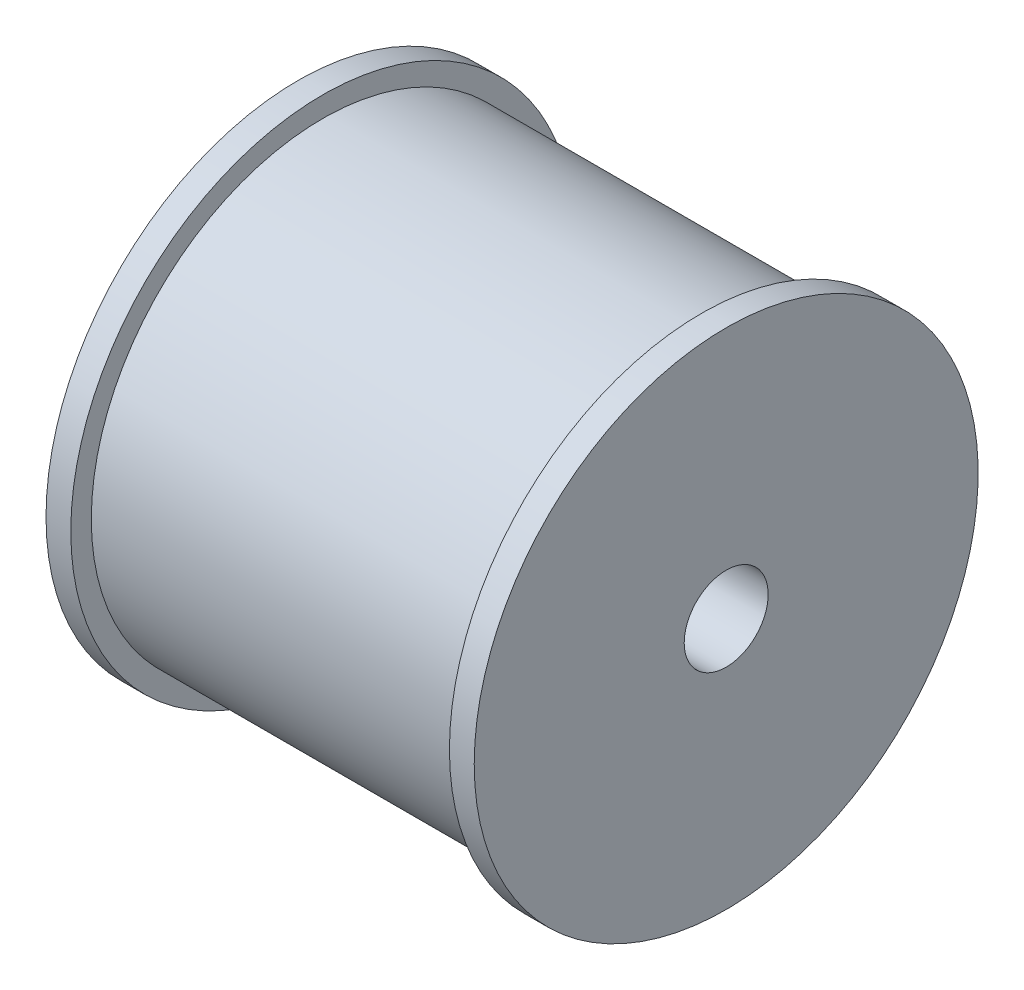
from build123d import *


with BuildPart() as part:
    # Sketch1 → Revolve1 (revolve)
    with BuildSketch(Plane.XY, mode=Mode.PRIVATE) as revolve1_sk:
        Polygon((0, 25.4), (0, 152.4), (15, 152.4), (15, 140), (244, 140), (244, 152.4), (259, 152.4), (259, 25.4), align=None)
    revolve(revolve1_sk.sketch.rotate(Axis((0, 0, 0), (1, 0, 0)), 90), axis=Axis((0, 0, 0), (1, 0, 0)))


solid = part.part
